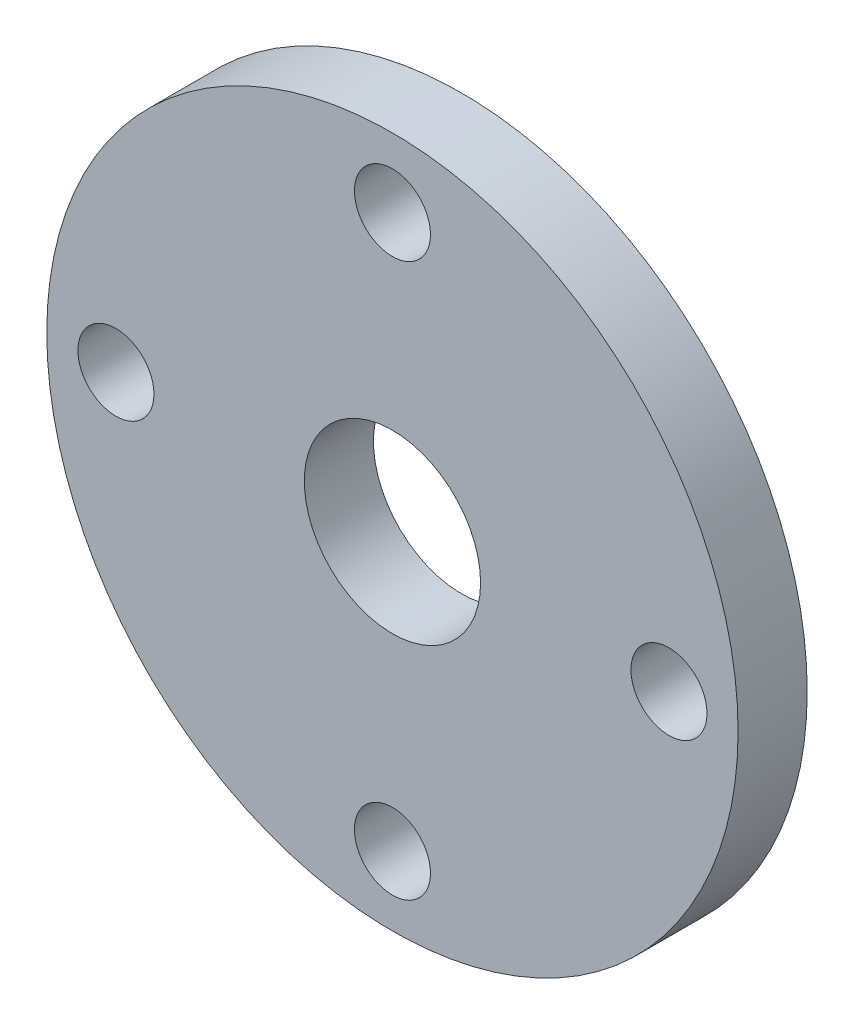
from build123d import *

# Parameters (mm, degrees)
HORN_PLATE_ENVELOPE_PROFILE_R           = 10
HORN_PLATE_ENVELOPE_PROFILE_R_2         = 2.55
HORN_PLATE_ENVELOPE_DEPTH               = 2
NOMINAL_HORN_ATTACHMENT_HOLES_START     = -50
NOMINAL_HORN_ATTACHMENT_HOLES_PROFILE_R = 1.1
NOMINAL_HORN_ATTACHMENT_HOLES_DEPTH     = 65.282856857


with BuildPart() as part:
    # Horn_plate_envelope_profile → Horn_plate_envelope (new body)
    with BuildSketch(Plane.XY):
        Circle(HORN_PLATE_ENVELOPE_PROFILE_R)
        Circle(HORN_PLATE_ENVELOPE_PROFILE_R_2, mode=Mode.SUBTRACT)
    extrude(amount=HORN_PLATE_ENVELOPE_DEPTH)

    # Nominal_horn_attachment_holes_profile → Nominal_horn_attachment_holes (cut, through all)
    with BuildSketch(Plane.XY.offset(NOMINAL_HORN_ATTACHMENT_HOLES_START)):
        with Locations((-8, 0)):
            Circle(NOMINAL_HORN_ATTACHMENT_HOLES_PROFILE_R)
        with Locations((8, 0)):
            Circle(NOMINAL_HORN_ATTACHMENT_HOLES_PROFILE_R)
        with Locations((0, -8)):
            Circle(NOMINAL_HORN_ATTACHMENT_HOLES_PROFILE_R)
        with Locations((0, 8)):
            Circle(NOMINAL_HORN_ATTACHMENT_HOLES_PROFILE_R)
    extrude(amount=NOMINAL_HORN_ATTACHMENT_HOLES_DEPTH, mode=Mode.SUBTRACT)


solid = part.part
